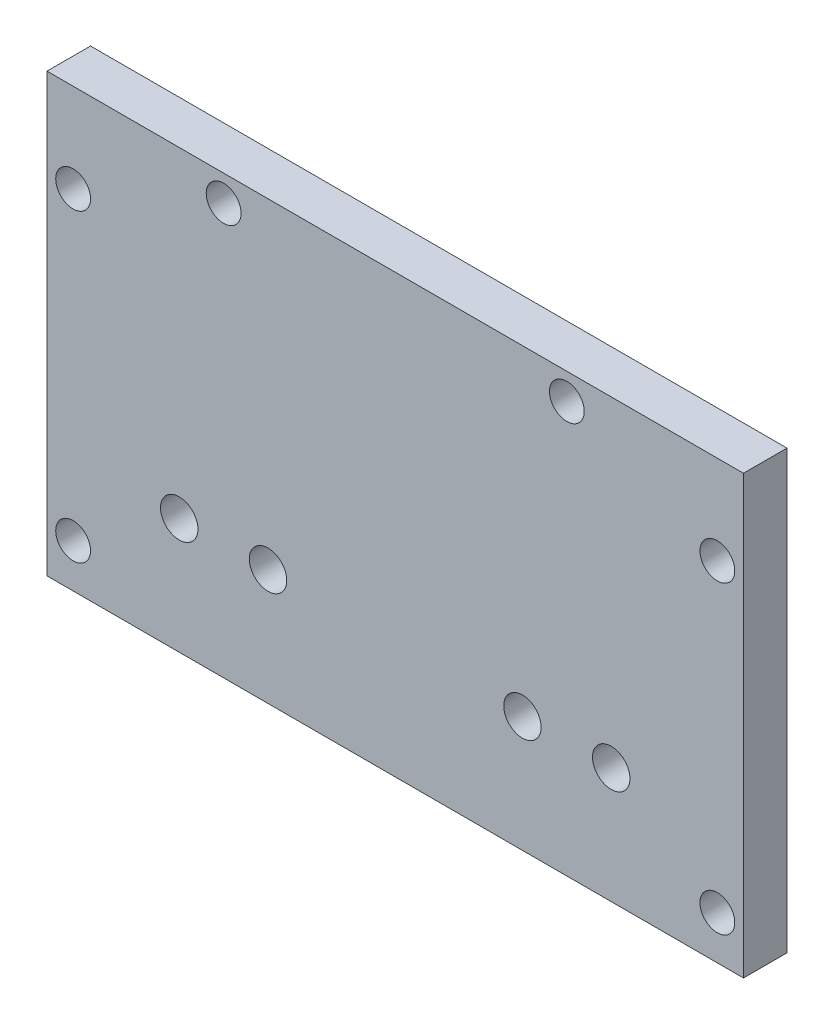
from build123d import *

# Parameters (mm, degrees)
SKETCH1_W           = 80
SKETCH1_H           = 50.211199845
SKETCH1_R           = 2.15
BOSS_EXTRUDE1_DEPTH = 5
SKETCH2_R           = 2
CUT_EXTRUDE1_DEPTH  = 10


with BuildPart() as part:
    # Sketch1 → Boss-Extrude1 (new body)
    with BuildSketch(Plane.XY):
        with Locations((0, 25.105599923)):
            Rectangle(SKETCH1_W, SKETCH1_H)
        with Locations((14.610738527, 13.311199845)):
            Circle(SKETCH1_R, mode=Mode.SUBTRACT)
        with Locations((24.810738527, 13.311199845)):
            Circle(SKETCH1_R, mode=Mode.SUBTRACT)
        with Locations((-14.610738527, 13.311199845)):
            Circle(SKETCH1_R, mode=Mode.SUBTRACT)
        with Locations((-24.810738527, 13.311199845)):
            Circle(SKETCH1_R, mode=Mode.SUBTRACT)
    extrude(amount=BOSS_EXTRUDE1_DEPTH)

    # Sketch2 → Cut-Extrude1 (cut)
    with BuildSketch(Plane(origin=(0, 0, 0), x_dir=(-1, 0, 0), z_dir=(0, 0, -1))):
        with Locations((19.710738527, 47.211199845)):
            Circle(SKETCH2_R)
        with Locations((-19.710738527, 47.211199845)):
            Circle(SKETCH2_R)
        with Locations((37, 40)):
            Circle(SKETCH2_R)
        with Locations((-37, 40)):
            Circle(SKETCH2_R)
        with Locations((37, 5)):
            Circle(SKETCH2_R)
        with Locations((-37, 5)):
            Circle(SKETCH2_R)
    extrude(amount=-CUT_EXTRUDE1_DEPTH, mode=Mode.SUBTRACT)


solid = part.part
